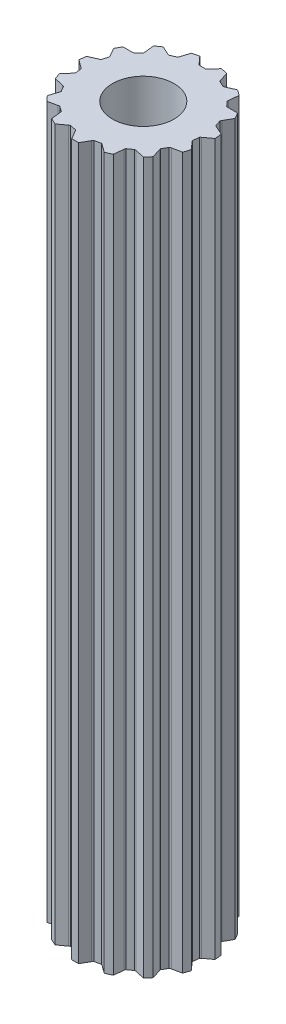
from build123d import *

# Parameters (mm, degrees)
SKETCH1_R           = 6.604
BOSS_EXTRUDE3_DEPTH = 152.4


with BuildPart() as part:
    # Sketch1 → Boss-Extrude3 (new body)
    with BuildSketch(Plane(origin=(0, 0, 0), x_dir=(1, 0, 0), z_dir=(0, 1, 0))):
        with BuildLine():
            Line((-1.761094277, -12.824695235), (-0.744188415, -14.586027856))
            ThreePointArc((-0.744188415, -14.586027856), (0, -14.605), (0.744188415, -14.586027856))
            Line((0.744188415, -14.586027856), (1.761094277, -12.824695235))
            ThreePointArc((1.761094277, -12.824695235), (1.86082516, -12.676971002), (1.980255064, -12.544663801))
            ThreePointArc((1.980255064, -12.544663801), (2.640478473, -12.422474529), (3.293321424, -12.26556293))
            ThreePointArc((3.293321424, -12.26556293), (3.456240258, -12.337855055), (3.607433811, -12.432243652))
            Line((3.607433811, -12.432243652), (5.25282206, -13.62768819))
            ThreePointArc((5.25282206, -13.62768819), (5.940388672, -13.342331409), (6.612521952, -13.022310795))
            Line((6.612521952, -13.022310795), (6.825113166, -10.999640503))
            ThreePointArc((6.825113166, -10.999640503), (6.856137002, -10.824123497), (6.911427462, -10.654678336))
            ThreePointArc((6.911427462, -10.654678336), (7.464872704, -10.274515829), (7.997452719, -9.8656348))
            ThreePointArc((7.997452719, -9.8656348), (8.175690336, -9.865411882), (8.35220382, -9.890144198))
            Line((8.35220382, -9.890144198), (10.34157188, -10.312997433))
            ThreePointArc((10.34157188, -10.312997433), (10.853630176, -9.772652506), (11.33749037, -9.206917894))
            Line((11.33749037, -9.206917894), (10.709007984, -7.272647999))
            ThreePointArc((10.709007984, -7.272647999), (10.66596047, -7.099686705), (10.647551263, -6.922402191))
            ThreePointArc((10.647551263, -6.922402191), (10.998522628, -6.35), (11.318751785, -5.759848786))
            ThreePointArc((11.318751785, -5.759848786), (11.481489281, -5.687149371), (11.652801912, -5.637948964))
            Line((11.652801912, -5.637948964), (13.642169972, -5.215095729))
            ThreePointArc((13.642169972, -5.215095729), (13.89018042, -4.513193203), (14.102103706, -3.799565247))
            Line((14.102103706, -3.799565247), (12.741218033, -2.288148587))
            ThreePointArc((12.741218033, -2.288148587), (12.631542476, -2.147649583), (12.542616721, -1.99317982))
            ThreePointArc((12.542616721, -1.99317982), (12.630428071, -1.327511483), (12.682935839, -0.658132591))
            ThreePointArc((12.682935839, -0.658132591), (12.802034423, -0.525527067), (12.938524691, -0.410901134))
            Line((12.938524691, -0.410901134), (14.58391294, 0.784543404))
            ThreePointArc((14.58391294, 0.784543404), (14.524992282, 1.526638206), (14.428335197, 2.264766749))
            Line((14.428335197, 2.264766749), (12.570355734, 3.091992503))
            ThreePointArc((12.570355734, 3.091992503), (12.413016034, 3.175735662), (12.268949801, 3.280681449))
            ThreePointArc((12.268949801, 3.280681449), (12.078417757, 3.924515829), (11.854125066, 4.557380709))
            ThreePointArc((11.854125066, 4.557380709), (11.908991511, 4.726963641), (11.987059008, 4.887195235))
            Line((11.987059008, 4.887195235), (13.003964871, 6.648527856))
            ThreePointArc((13.003964871, 6.648527856), (12.648301022, 7.3025), (12.259776456, 7.9375))
            Line((12.259776456, 7.9375), (10.22596473, 7.9375))
            ThreePointArc((10.22596473, 7.9375), (10.048166351, 7.950007361), (9.873870001, 7.987283092))
            ThreePointArc((9.873870001, 7.987283092), (9.437939284, 8.497958701), (8.975628378, 8.984881481))
            ThreePointArc((8.975628378, 8.984881481), (8.956775776, 9.162119392), (8.962921923, 9.340251148))
            Line((8.962921923, 9.340251148), (9.175513137, 11.362921441))
            ThreePointArc((9.175513137, 11.362921441), (8.58460361, 11.815693203), (7.971390989, 12.237767391))
            Line((7.971390989, 12.237767391), (6.113411525, 11.410541637))
            ThreePointArc((6.113411525, 11.410541637), (5.945897421, 11.349650564), (5.771508377, 11.312810926))
            ThreePointArc((5.771508377, 11.312810926), (5.165555367, 11.602027312), (4.545164002, 11.85881462))
            ThreePointArc((4.545164002, 11.85881462), (4.455852141, 12.013061465), (4.389014213, 12.178292785))
            Line((4.389014213, 12.178292785), (3.760531826, 14.11256268))
            ThreePointArc((3.760531826, 14.11256268), (3.036550244, 14.285845709), (2.304679602, 14.422013623))
            Line((2.304679602, 14.422013623), (0.943793928, 12.910596963))
            ThreePointArc((0.943793928, 12.910596963), (0.81552881, 12.786836076), (0.671200521, 12.682250978))
            ThreePointArc((0.671200521, 12.682250978), (0, 12.7), (-0.671200521, 12.682250978))
            ThreePointArc((-0.671200521, 12.682250978), (-0.81552881, 12.786836076), (-0.943793928, 12.910596963))
            Line((-0.943793928, 12.910596963), (-2.304679602, 14.422013623))
            ThreePointArc((-2.304679602, 14.422013623), (-3.036550244, 14.285845709), (-3.760531826, 14.11256268))
            Line((-3.760531826, 14.11256268), (-4.389014213, 12.178292785))
            ThreePointArc((-4.389014213, 12.178292785), (-4.455852141, 12.013061465), (-4.545164002, 11.85881462))
            ThreePointArc((-4.545164002, 11.85881462), (-5.165555367, 11.602027312), (-5.771508377, 11.312810926))
            ThreePointArc((-5.771508377, 11.312810926), (-5.945897421, 11.349650564), (-6.113411525, 11.410541637))
            Line((-6.113411525, 11.410541637), (-7.971390989, 12.237767391))
            ThreePointArc((-7.971390989, 12.237767391), (-8.58460361, 11.815693203), (-9.175513137, 11.362921441))
            Line((-9.175513137, 11.362921441), (-8.962921923, 9.340251148))
            ThreePointArc((-8.962921923, 9.340251148), (-8.956775776, 9.162119392), (-8.975628378, 8.984881481))
            ThreePointArc((-8.975628378, 8.984881481), (-9.437939284, 8.497958701), (-9.873870001, 7.987283092))
            ThreePointArc((-9.873870001, 7.987283092), (-10.048166351, 7.950007361), (-10.22596473, 7.9375))
            Line((-10.22596473, 7.9375), (-12.259776456, 7.9375))
            ThreePointArc((-12.259776456, 7.9375), (-12.648301022, 7.3025), (-13.003964871, 6.648527856))
            Line((-13.003964871, 6.648527856), (-11.987059008, 4.887195235))
            ThreePointArc((-11.987059008, 4.887195235), (-11.908991511, 4.726963641), (-11.854125066, 4.557380709))
            ThreePointArc((-11.854125066, 4.557380709), (-12.078417757, 3.924515829), (-12.268949801, 3.280681449))
            ThreePointArc((-12.268949801, 3.280681449), (-12.413016034, 3.175735662), (-12.570355734, 3.091992503))
            Line((-12.570355734, 3.091992503), (-14.428335197, 2.264766749))
            ThreePointArc((-14.428335197, 2.264766749), (-14.524992282, 1.526638206), (-14.58391294, 0.784543404))
            Line((-14.58391294, 0.784543404), (-12.938524691, -0.410901134))
            ThreePointArc((-12.938524691, -0.410901134), (-12.802034423, -0.525527067), (-12.682935839, -0.658132591))
            ThreePointArc((-12.682935839, -0.658132591), (-12.630428071, -1.327511483), (-12.542616721, -1.99317982))
            ThreePointArc((-12.542616721, -1.99317982), (-12.631542476, -2.147649583), (-12.741218033, -2.288148587))
            Line((-12.741218033, -2.288148587), (-14.102103706, -3.799565247))
            ThreePointArc((-14.102103706, -3.799565247), (-13.89018042, -4.513193203), (-13.642169972, -5.215095729))
            Line((-13.642169972, -5.215095729), (-11.652801912, -5.637948964))
            ThreePointArc((-11.652801912, -5.637948964), (-11.481489281, -5.687149371), (-11.318751785, -5.759848786))
            ThreePointArc((-11.318751785, -5.759848786), (-10.998522628, -6.35), (-10.647551263, -6.922402191))
            ThreePointArc((-10.647551263, -6.922402191), (-10.66596047, -7.099686705), (-10.709007984, -7.272647999))
            Line((-10.709007984, -7.272647999), (-11.33749037, -9.206917894))
            ThreePointArc((-11.33749037, -9.206917894), (-10.853630176, -9.772652506), (-10.34157188, -10.312997433))
            Line((-10.34157188, -10.312997433), (-8.35220382, -9.890144198))
            ThreePointArc((-8.35220382, -9.890144198), (-8.175690336, -9.865411882), (-7.997452719, -9.8656348))
            ThreePointArc((-7.997452719, -9.8656348), (-7.464872704, -10.274515829), (-6.911427462, -10.654678336))
            ThreePointArc((-6.911427462, -10.654678336), (-6.856137002, -10.824123497), (-6.825113166, -10.999640503))
            Line((-6.825113166, -10.999640503), (-6.612521952, -13.022310795))
            ThreePointArc((-6.612521952, -13.022310795), (-5.940388672, -13.342331409), (-5.25282206, -13.62768819))
            Line((-5.25282206, -13.62768819), (-3.607433811, -12.432243652))
            ThreePointArc((-3.607433811, -12.432243652), (-3.456240258, -12.337855055), (-3.293321424, -12.26556293))
            ThreePointArc((-3.293321424, -12.26556293), (-2.640478473, -12.422474529), (-1.980255064, -12.544663801))
            ThreePointArc((-1.980255064, -12.544663801), (-1.86082516, -12.676971002), (-1.761094277, -12.824695235))
        make_face()
        with Locations(Location((0, 0, 0), (0, 0, 90))):
            Circle(SKETCH1_R, mode=Mode.SUBTRACT)
    extrude(amount=BOSS_EXTRUDE3_DEPTH)


solid = part.part
